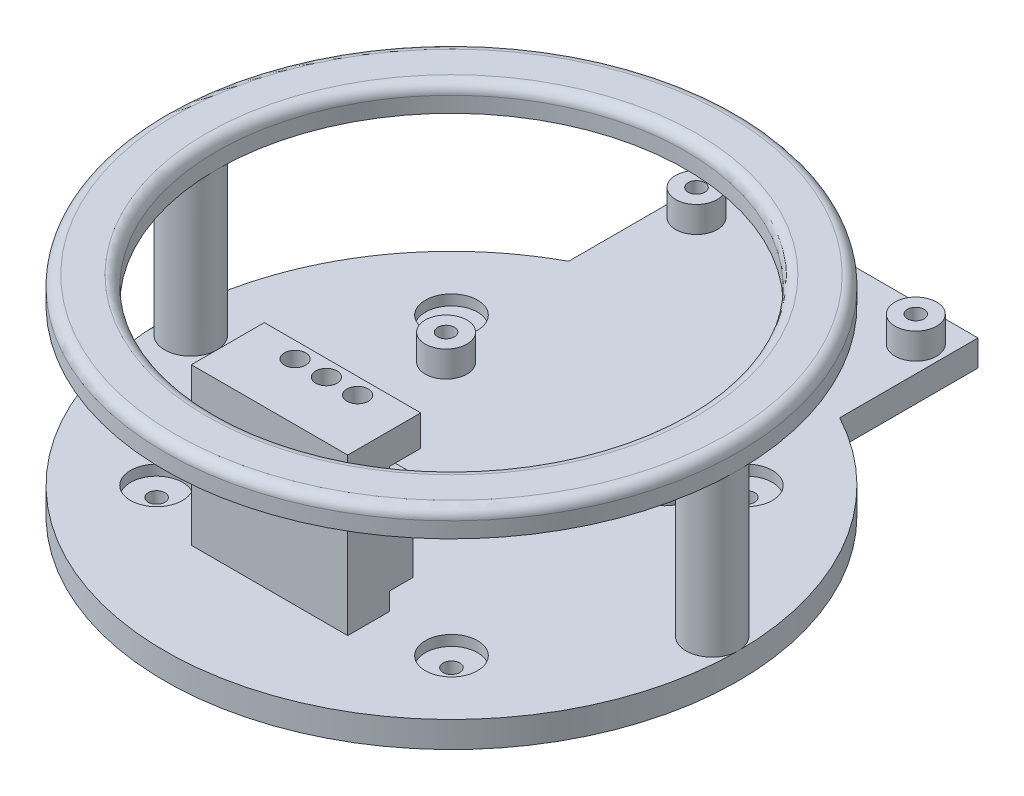
from build123d import *
from build123d.topology import SkipClean

# Parameters (mm, degrees)
SKETCH1_R           = 55
BOSS_EXTRUDE1_DEPTH = 5
SKETCH2_W           = 30
SKETCH2_H           = 14
BOSS_EXTRUDE2_DEPTH = 30
SKETCH6_R           = 2.05
CUT_EXTRUDE3_DEPTH  = 30
SKETCH7_W           = 30
SKETCH7_H           = 3.4
CUT_EXTRUDE4_DEPTH  = 6
SKETCH8_R           = 5
BOSS_EXTRUDE3_DEPTH = 30
CIRPATTERN1_COUNT   = 2
SKETCH9_R           = 55
SKETCH9_R_2         = 45
BOSS_EXTRUDE4_DEPTH = 5
SKETCH10_R          = 1.6
CUT_EXTRUDE5_DEPTH  = 6
SKETCH11_W          = 30
SKETCH11_H          = 17.3
CUT_EXTRUDE6_DEPTH  = 1.5
BOSS_EXTRUDE5_DEPTH = 5
SKETCH16_R          = 4
BOSS_EXTRUDE6_DEPTH = 5
SKETCH17_R          = 1.6
CUT_EXTRUDE8_DEPTH  = 98.724101428
SKETCH13_R          = 5
CUT_EXTRUDE9_DEPTH  = 2
CIRPATTERN3_COUNT   = 4
FILLET1_R           = 2


with BuildPart() as part:
    # Sketch1 → Boss-Extrude1 (new body)
    with BuildSketch(Plane(origin=(0, 0, 0), x_dir=(1, 0, 0), z_dir=(0, 1, 0))):
        with Locations(Location((0, 0, 0), (0, 0, 270))):
            Circle(SKETCH1_R)
    extrude(amount=BOSS_EXTRUDE1_DEPTH)

    # Sketch2 → Boss-Extrude2 (add)
    with BuildSketch(Plane(origin=(0, 5, 0), x_dir=(1, 0, 0), z_dir=(0, 1, 0))):
        with Locations((0, -27.9)):
            Rectangle(SKETCH2_W, SKETCH2_H)
    extrude(amount=BOSS_EXTRUDE2_DEPTH)

    # Sketch6 → Cut-Extrude3 (cut)
    with BuildSketch(Plane(origin=(0, 35, 0), x_dir=(1, 0, 0), z_dir=(0, 1, 0))):
        with Locations(Location((-6, -24, 0), (0, 0, 270))):
            Circle(SKETCH6_R)
        with Locations(Location((0, -24, 0), (0, 0, 270))):
            Circle(SKETCH6_R)
        with Locations(Location((6, -24, 0), (0, 0, 270))):
            Circle(SKETCH6_R)
    extrude(amount=-CUT_EXTRUDE3_DEPTH, mode=Mode.SUBTRACT)

    # Sketch7 → Cut-Extrude4 (cut)
    with BuildSketch(Plane(origin=(0, 0, 20.9), x_dir=(-1, 0, 0), z_dir=(0, 0, -1))):
        with Locations((0, 6.7)):
            Rectangle(SKETCH7_W, SKETCH7_H)
        with Locations((0, 27.4)):
            Rectangle(SKETCH7_W, SKETCH7_H)
    extrude(amount=-CUT_EXTRUDE4_DEPTH, mode=Mode.SUBTRACT)

    # Sketch8 → Boss-Extrude3 (add)
    with BuildSketch(Plane(origin=(0, 5, 0), x_dir=(1, 0, 0), z_dir=(0, 1, 0))):
        with Locations(Location((-50, 0, 0), (0, 0, 180))):
            Circle(SKETCH8_R)
    boss_extrude3 = extrude(amount=BOSS_EXTRUDE3_DEPTH)

    # CirPattern1: Boss-Extrude3 ×2 about axis
    cirpattern1_axis = Axis((0, 0, 0), (0, 1, 0))
    for i in range(1, CIRPATTERN1_COUNT):
        add(boss_extrude3.rotate(cirpattern1_axis, i * 360 / CIRPATTERN1_COUNT))

    # Sketch9 → Boss-Extrude4 (add)
    with BuildSketch(Plane(origin=(0, 35, 0), x_dir=(1, 0, 0), z_dir=(0, 1, 0))):
        with Locations(Location((0, 0, 0), (0, 0, 3.4551e-05))):
            Circle(SKETCH9_R)
        Circle(SKETCH9_R_2, mode=Mode.SUBTRACT)
    extrude(amount=BOSS_EXTRUDE4_DEPTH)

    # Sketch10 → Cut-Extrude5 (cut)
    with BuildSketch(Plane.XZ):
        with Locations(Location((-28.284271247, 28.284271247, 0), (0, 0, 270))):
            Circle(SKETCH10_R)
        with Locations(Location((28.284271247, 28.284271247, 0), (0, 0, 270))):
            Circle(SKETCH10_R)
        with Locations(Location((28.284271247, -28.284271247, 0), (0, 0, 270))):
            Circle(SKETCH10_R)
        with Locations(Location((-28.284271247, -28.284271247, 0), (0, 0, 270))):
            Circle(SKETCH10_R)
    extrude(amount=-CUT_EXTRUDE5_DEPTH, mode=Mode.SUBTRACT)

    # Sketch11 → Cut-Extrude6 (cut)
    with BuildSketch(Plane(origin=(0, 0, 20.9), x_dir=(-1, 0, 0), z_dir=(0, 0, -1))):
        with Locations((0, 17.05)):
            Rectangle(SKETCH11_W, SKETCH11_H)
    extrude(amount=-CUT_EXTRUDE6_DEPTH, mode=Mode.SUBTRACT)

    # Sketch14 → Boss-Extrude5 (add)
    with SkipClean():  # the faces are left unmerged after this step: merging them gives an invalid solid
        with BuildSketch(Plane.XZ):
            Polygon((-26, -48.466483264), (-26, -75), (26, -75), (26, -25), (-26, -25), align=None)
        extrude(amount=-BOSS_EXTRUDE5_DEPTH)

    # Sketch16 → Boss-Extrude6 (add)
    with BuildSketch(Plane(origin=(0, 5, 0), x_dir=(1, 0, 0), z_dir=(0, 1, 0))):
        with Locations(Location((-21, 68, 0), (0, 0, 270))):
            Circle(SKETCH16_R)
        with Locations(Location((21.07, 68, 0), (0, 0, 270))):
            Circle(SKETCH16_R)
        with Locations(Location((-21, 19.96, 0), (0, 0, 270))):
            Circle(SKETCH16_R)
        with Locations(Location((21.07, 19.96, 0), (0, 0, 270))):
            Circle(SKETCH16_R)
    extrude(amount=BOSS_EXTRUDE6_DEPTH)

    # Sketch17 → Cut-Extrude8 (cut, through all)
    with BuildSketch(Plane(origin=(0, 10, 0), x_dir=(1, 0, 0), z_dir=(0, 1, 0))):
        with Locations(Location((-21, 68, 0), (0, 0, 270))):
            Circle(SKETCH17_R)
        with Locations(Location((21.07, 68, 0), (0, 0, 270))):
            Circle(SKETCH17_R)
        with Locations(Location((21.07, 19.96, 0), (0, 0, 270))):
            Circle(SKETCH17_R)
        with Locations(Location((-21, 19.96, 0), (0, 0, 270))):
            Circle(SKETCH17_R)
    extrude(amount=-CUT_EXTRUDE8_DEPTH, mode=Mode.SUBTRACT)

    # Sketch13 → Cut-Extrude9 (cut)
    with BuildSketch(Plane(origin=(0, 5, 0), x_dir=(1, 0, 0), z_dir=(0, 1, 0))):
        with Locations(Location((-28.284271247, 28.284271247, 0), (0, 0, 270))):
            Circle(SKETCH13_R)
    cut_extrude9 = extrude(amount=-CUT_EXTRUDE9_DEPTH, mode=Mode.SUBTRACT)

    # CirPattern3: Cut-Extrude9 ×4 about axis
    cirpattern3_axis = Axis((0, 0, 0), (0, 1, 0))
    for i in range(1, CIRPATTERN3_COUNT):
        add(cut_extrude9.rotate(cirpattern3_axis, i * 360 / CIRPATTERN3_COUNT), mode=Mode.SUBTRACT)

    # Fillet1
    fillet1_edges = [part.edges().sort_by_distance(p)[0] for p in [
        (-55, 40, 3.3167e-05),
        (-45, 40, 0),
    ]]
    fillet(fillet1_edges, radius=FILLET1_R)


solid = part.part
